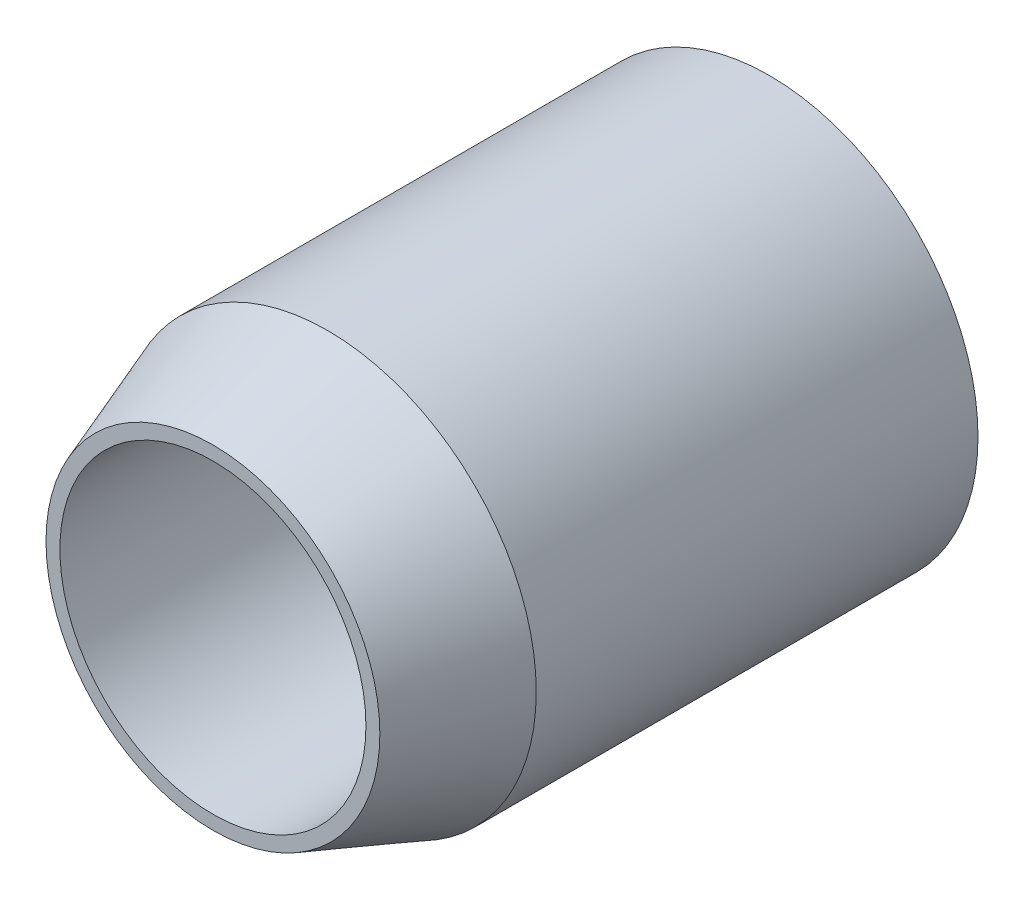
from build123d import *

# Parameters (mm, degrees)
SKETCH1_R           = 7.5
BOSS_EXTRUDE1_DEPTH = 20
SKETCH2_R           = 5.5
CUT_EXTRUDE1_DEPTH  = 10
CHAMFER1_SIZE       = 1.5
CHAMFER1_SIZE2      = 4.121216129
SKETCH3_R           = 1.75
CUT_EXTRUDE2_DEPTH  = 23.638462845


with BuildPart() as part:
    # Sketch1 → Boss-Extrude1 (new body)
    with BuildSketch(Plane.XY):
        Circle(SKETCH1_R)
    extrude(amount=BOSS_EXTRUDE1_DEPTH)

    # Sketch2 → Cut-Extrude1 (cut)
    with BuildSketch(Plane.XY.offset(20)):
        Circle(SKETCH2_R)
    extrude(amount=-CUT_EXTRUDE1_DEPTH, mode=Mode.SUBTRACT)

    # Chamfer1
    chamfer1_edges = [part.edges().sort_by_distance(p)[0] for p in [
        (-7.5, 0, 20),
    ]]
    chamfer1_side = [part.faces().sort_by_distance(p)[0] for p in [
        (-7.287867966, 0, 20),
    ]]
    chamfer(chamfer1_edges, length=CHAMFER1_SIZE, length2=CHAMFER1_SIZE2, reference=chamfer1_side[0])

    # Sketch3 → Cut-Extrude2 (cut, through all)
    with BuildSketch(Plane(origin=(0, 0, 0), x_dir=(-1, 0, 0), z_dir=(0, 0, -1))):
        Circle(SKETCH3_R)
    extrude(amount=-CUT_EXTRUDE2_DEPTH, mode=Mode.SUBTRACT)


solid = part.part
